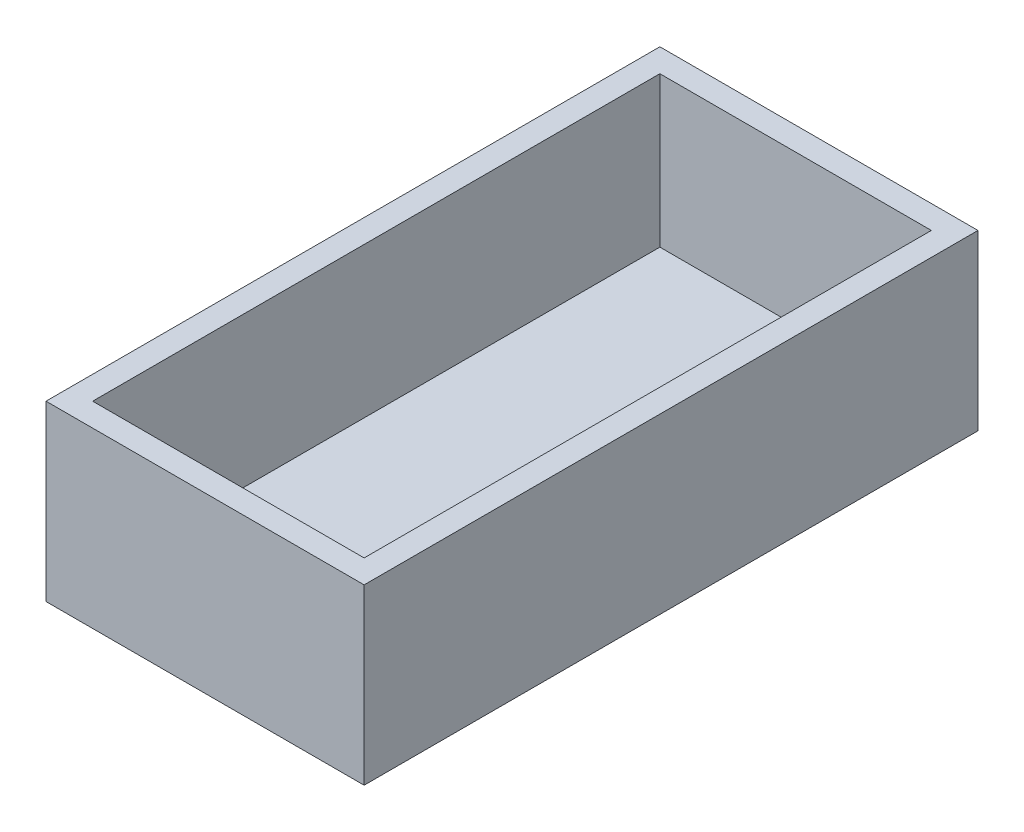
from build123d import *

# Parameters (mm, degrees)
SKETCH3_W           = 43.307
SKETCH3_H           = 83.566
BOSS_EXTRUDE1_DEPTH = 23.622
SHELL2_T            = -3.175


with BuildPart() as part:
    # Sketch3 → Boss-Extrude1 (new body)
    with BuildSketch(Plane(origin=(0, 0, 0), x_dir=(1, 0, 0), z_dir=(0, 1, 0))):
        with Locations((-1.5875, 0)):
            Rectangle(SKETCH3_W, SKETCH3_H)
    extrude(amount=BOSS_EXTRUDE1_DEPTH)

    # Shell2
    shell2_openings = [part.faces().sort_by_distance(p)[0] for p in [
        (-1.5875, 23.622, 0),
    ]]
    offset(amount=SHELL2_T, openings=shell2_openings, kind=Kind.INTERSECTION)


solid = part.part
